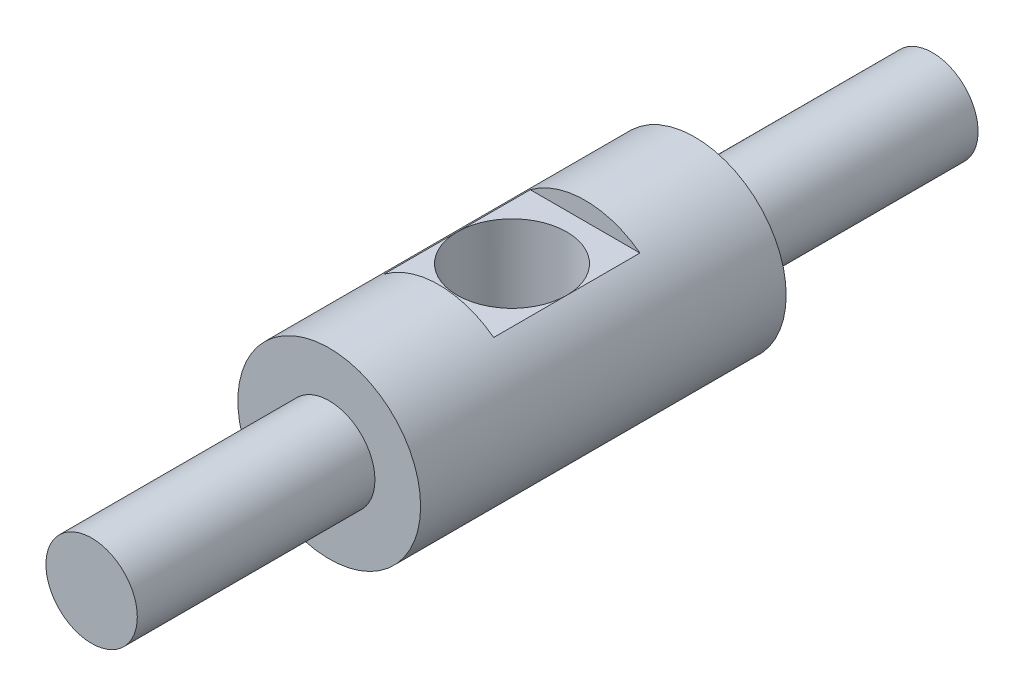
from build123d import *

# Parameters (mm, degrees)
IZIM1_R                     = 25
Y_KSEKLIK_EKSTR_ZYON1_DEPTH = 100
IZIM2_R                     = 12.5
Y_KSEKLIK_EKSTR_ZYON2_DEPTH = 65
Y_KSEKLIK_EKSTR_ZYON3_START = 65
IZIM3_R                     = 12.5
Y_KSEKLIK_EKSTR_ZYON3_DEPTH = 65
KES_EKSTR_ZYON1_DEPTH       = 65
KES_EKSTR_ZYON1_DEPTH_BACK  = 65
IZIM4_R                     = 15
KES_EKSTR_ZYON2_START       = 20
IZIM5_W                     = 40
IZIM5_H                     = 40
KES_EKSTR_ZYON2_DEPTH       = 10


with BuildPart() as part:
    # Çizim1 → Yükseklik-Ekstrüzyon1 (new body)
    with BuildSketch(Plane.XY):
        Circle(IZIM1_R)
    extrude(amount=Y_KSEKLIK_EKSTR_ZYON1_DEPTH)

    # Çizim2 → Yükseklik-Ekstrüzyon2 (add)
    with BuildSketch(Plane.XY.offset(100)):
        Circle(IZIM2_R)
    extrude(amount=Y_KSEKLIK_EKSTR_ZYON2_DEPTH)

    # Çizim3 → Yükseklik-Ekstrüzyon3 (add)
    with BuildSketch(Plane(origin=(0, 0, 0), x_dir=(-1, 0, 0), z_dir=(0, 0, -1)).offset(Y_KSEKLIK_EKSTR_ZYON3_START)):
        Circle(IZIM3_R)
    extrude(amount=-Y_KSEKLIK_EKSTR_ZYON3_DEPTH)

    # Çizim4 → Kes-Ekstrüzyon1 (cut, two sides: drawn at the far end of the back side and taken through both)
    with BuildSketch(Plane(origin=(0, 0, 0), x_dir=(1, 0, 0), z_dir=(0, 1, 0)).offset(-KES_EKSTR_ZYON1_DEPTH_BACK)):
        with Locations((0, -50)):
            Circle(IZIM4_R)
    extrude(amount=KES_EKSTR_ZYON1_DEPTH + KES_EKSTR_ZYON1_DEPTH_BACK, mode=Mode.SUBTRACT)

    # Çizim5 → Kes-Ekstrüzyon2 (cut)
    with BuildSketch(Plane(origin=(0, 0, 0), x_dir=(1, 0, 0), z_dir=(0, 1, 0)).offset(KES_EKSTR_ZYON2_START)):
        with Locations((0, -50)):
            Rectangle(IZIM5_W, IZIM5_H)
    extrude(amount=KES_EKSTR_ZYON2_DEPTH, mode=Mode.SUBTRACT)


solid = part.part
